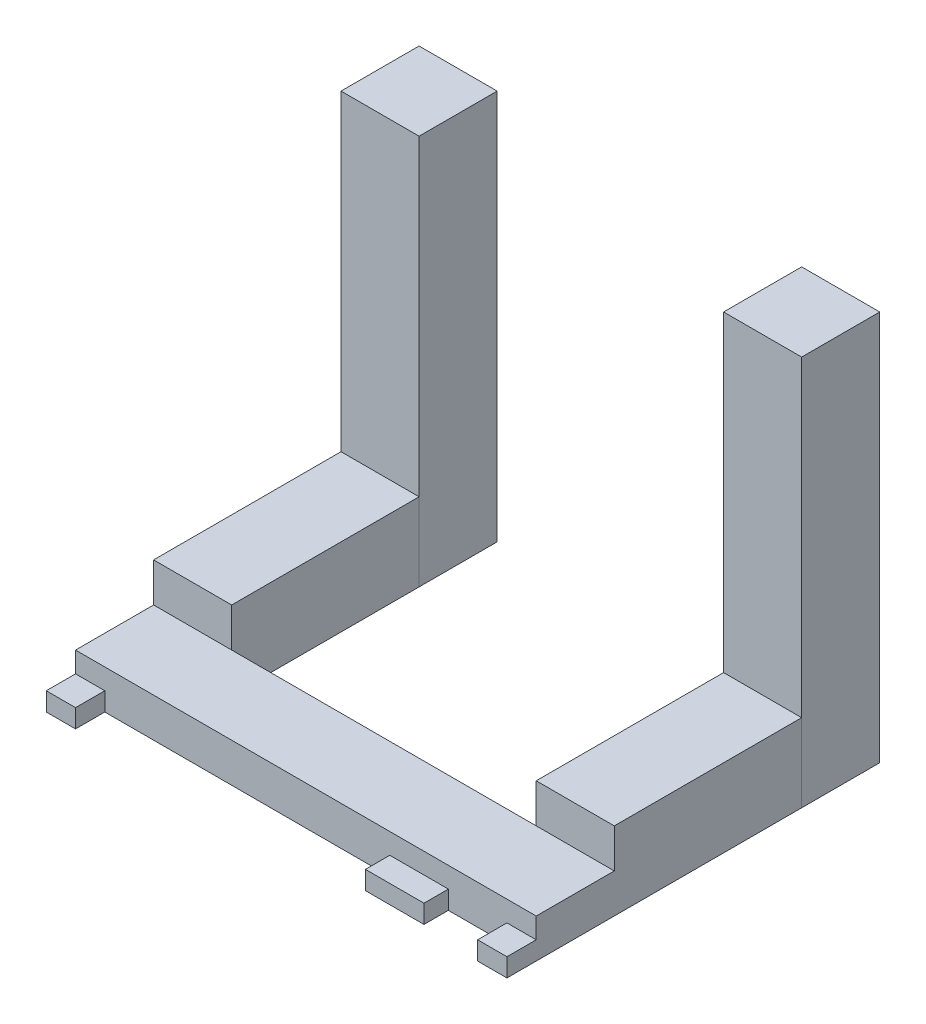
from build123d import *

# Parameters (mm, degrees)
SKETCH1_W             = 12.7
SKETCH1_H             = 12.7
BOSS_EXTRUDE1_DEPTH   = 63.5
BOSS_EXTRUDE1_2_DEPTH = 63.5
SKETCH5_W             = 12.7
SKETCH5_H             = 12.7
BOSS_EXTRUDE5_DEPTH   = 30.48
BOSS_EXTRUDE5_2_DEPTH = 30.48
SKETCH6_W             = 74.93
SKETCH6_H             = 6.35
BOSS_EXTRUDE6_DEPTH   = 12.7
SKETCH4_W             = 9.525
SKETCH4_H             = 3
BOSS_EXTRUDE4_DEPTH   = 3.96875
SKETCH3_W             = 4.7625
SKETCH3_H             = 3
BOSS_EXTRUDE7_DEPTH   = 4.7625


with BuildPart() as part:
    # Sketch1 → Boss-Extrude1 (new body)
    with BuildSketch(Plane(origin=(0, 0, 0), x_dir=(1, 0, 0), z_dir=(0, 1, 0))):
        with Locations((-68.58, 6.35)):
            Rectangle(SKETCH1_W, SKETCH1_H)
    extrude(amount=BOSS_EXTRUDE1_DEPTH)


with BuildPart() as body_2:
    # Sketch1 → Boss-Extrude1 2 (new body)
    with BuildSketch(Plane(origin=(0, 0, 0), x_dir=(1, 0, 0), z_dir=(0, 1, 0))):
        with Locations((-6.35, 6.35)):
            Rectangle(SKETCH1_W, SKETCH1_H)
    extrude(amount=BOSS_EXTRUDE1_2_DEPTH)


with BuildPart() as body_3:
    # Sketch5 → Boss-Extrude5 (new body)
    with BuildSketch(Plane.XY):
        with Locations((-68.58, 6.35)):
            Rectangle(SKETCH5_W, SKETCH5_H)
    extrude(amount=BOSS_EXTRUDE5_DEPTH)



with BuildPart() as body_4:
    # Sketch5 → Boss-Extrude5 2 (new body)
    with BuildSketch(Plane.XY):
        with Locations((-6.35, 6.35)):
            Rectangle(SKETCH5_W, SKETCH5_H)
    extrude(amount=BOSS_EXTRUDE5_2_DEPTH)


with BuildPart() as body_3_1:
    add(body_3.part)

    add(body_4.part)  # Boss-Extrude6 merges body 4
    # Sketch6 → Boss-Extrude6 (add)
    with BuildSketch(Plane.XY.offset(30.48)):
        with Locations((-37.465, 3.175)):
            Rectangle(SKETCH6_W, SKETCH6_H)
    extrude(amount=BOSS_EXTRUDE6_DEPTH)

    # Sketch4 → Boss-Extrude4 (add)
    with BuildSketch(Plane.XY.offset(43.18)):
        with Locations((-19.05, 1.5)):
            Rectangle(SKETCH4_W, SKETCH4_H)
    extrude(amount=BOSS_EXTRUDE4_DEPTH)

    # Sketch3 → Boss-Extrude7 (add)
    with BuildSketch(Plane.XY.offset(43.18)):
        with Locations((-2.38125, 1.5)):
            Rectangle(SKETCH3_W, SKETCH3_H)
    boss_extrude7 = extrude(amount=BOSS_EXTRUDE7_DEPTH)

    # Mirror2: Boss-Extrude7 across plane
    add(boss_extrude7.mirror(Plane(origin=(-37.465, 0, 0), x_dir=(0, 0, 1), z_dir=(1, 0, 0))))


solid = Compound([part.part, body_2.part, body_3_1.part])
